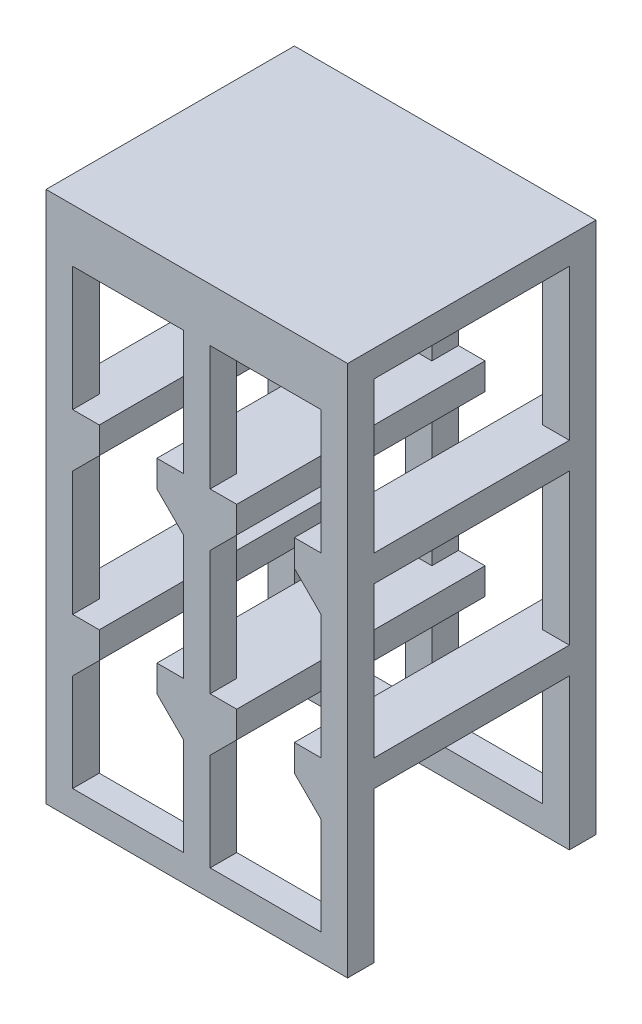
from build123d import *

# Parameters (mm, degrees)
SKETCH1_W               = 340
SKETCH1_H               = 280
BOSS_EXTRUDE1_DEPTH     = 600
CUT_EXTRUDE1_DEPTH      = 704.70448343
CUT_EXTRUDE1_DEPTH_BACK = 704.70448343
SKETCH4_W               = 220
SKETCH4_H               = 170
CUT_EXTRUDE3_DEPTH      = 684.593446429
CUT_EXTRUDE3_DEPTH_BACK = 684.593446429
SKETCH6_W               = 125
SKETCH6_H               = 110


with BuildPart() as part:
    # Sketch1 → Boss-Extrude1 (new body)
    with BuildSketch(Plane(origin=(0, 0, 0), x_dir=(1, 0, 0), z_dir=(0, 1, 0))):
        Rectangle(SKETCH1_W, SKETCH1_H)
    extrude(amount=BOSS_EXTRUDE1_DEPTH)

    # Sketch4 → Cut-Extrude1 (cut, two sides: drawn at the far end of the back side and taken through both)
    with BuildSketch(Plane(origin=(170, 0, 0), x_dir=(0, 0, -1), z_dir=(1, 0, 0)).offset(-CUT_EXTRUDE1_DEPTH_BACK)):
        with Locations((0, 485)):
            Rectangle(SKETCH4_W, SKETCH4_H)
        with Locations((0, 285)):
            Rectangle(SKETCH4_W, SKETCH4_H)
        with Locations((0, 85)):
            Rectangle(SKETCH4_W, SKETCH4_H)
    extrude(amount=CUT_EXTRUDE1_DEPTH + CUT_EXTRUDE1_DEPTH_BACK, mode=Mode.SUBTRACT)

    # Sketch6 → Cut-Extrude3 (cut, two sides: drawn at the far end of the back side and taken through both)
    with BuildSketch(Plane.XY.offset(140).offset(-CUT_EXTRUDE3_DEPTH_BACK)):
        Polygon((-15, 540), (-140, 540), (-140, 400), (-110, 400), (-110, 370), (-45, 370), (-45, 400), (-15, 400), align=None)
        Polygon((140, 540), (15, 540), (15, 400), (45, 400), (45, 370), (110, 370), (110, 400), (140, 400), align=None)
        Polygon((140, 340), (15, 340), (15, 200), (45, 200), (45, 170), (110, 170), (110, 200), (140, 200), align=None)
        Polygon((-15, 340), (-140, 340), (-140, 200), (-110, 200), (-110, 170), (-45, 170), (-45, 200), (-15, 200), align=None)
        with Locations((-77.5, 85)):
            Rectangle(SKETCH6_W, SKETCH6_H)
        with Locations((77.5, 85)):
            Rectangle(SKETCH6_W, SKETCH6_H)
        Polygon((-45, 170), (-110, 170), (-140, 140), (-15, 140), align=None)
        Polygon((110, 170), (45, 170), (15, 140), (140, 140), align=None)
        Polygon((110, 370), (45, 370), (15, 340), (140, 340), align=None)
        Polygon((-45, 370), (-110, 370), (-140, 340), (-15, 340), align=None)
    extrude(amount=CUT_EXTRUDE3_DEPTH + CUT_EXTRUDE3_DEPTH_BACK, mode=Mode.SUBTRACT)


solid = part.part
